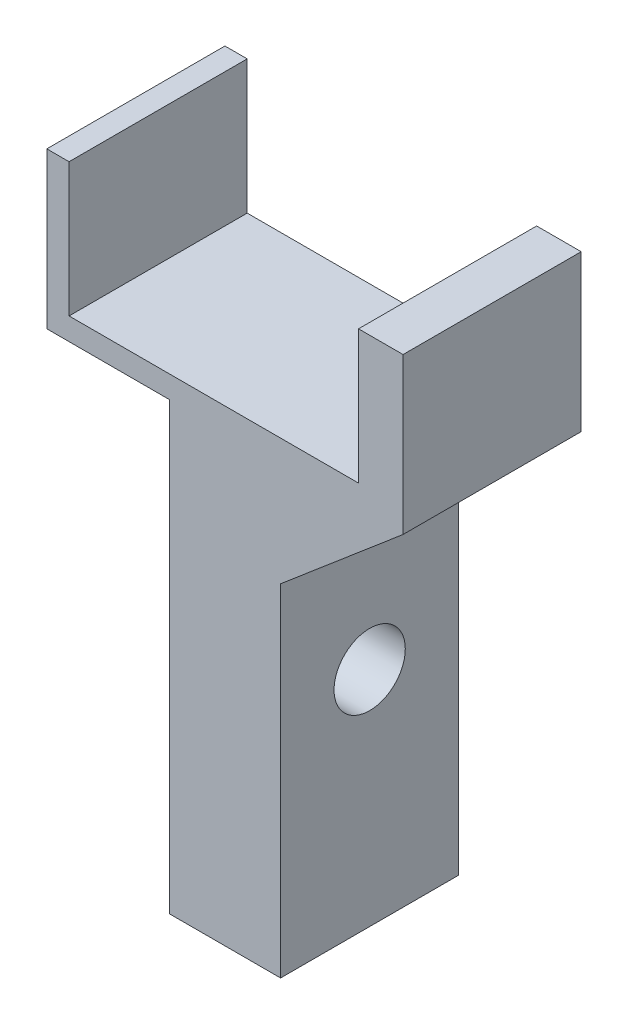
from build123d import *

# Parameters (mm, degrees)
EXTRUDE_4_DEPTH     = 8
SKETCH_7_W          = 13
SKETCH_7_H          = 6.499106166
CUT_EXTRUDE_3_DEPTH = 31.054117854
SKETCH_8_R          = 1.6
CUT_EXTRUDE_4_DEPTH = 31.054117854


with BuildPart() as part:
    # 草图6 → 凸台-拉伸4 (new body)
    with BuildSketch(Plane.XY):
        Polygon((-5, 20), (-10.5, 20), (-10.5, 27), (5.5, 27), (5.5, 20), (0, 15.33359454), (0, 0), (-5, 0), align=None)
    extrude(amount=EXTRUDE_4_DEPTH)

    # 草图7 → 切除-拉伸3 (cut, through all)
    with BuildSketch(Plane(origin=(0, 0, 0), x_dir=(-1, 0, 0), z_dir=(0, 0, -1))):
        with Locations((3, 24.249553083)):
            Rectangle(SKETCH_7_W, SKETCH_7_H)
    extrude(amount=-CUT_EXTRUDE_3_DEPTH, mode=Mode.SUBTRACT)

    # 草图8 → 切除-拉伸4 (cut, through all)
    with BuildSketch(Plane(origin=(0, 0, 0), x_dir=(0, 0, -1), z_dir=(1, 0, 0))):
        with Locations((-4, 10)):
            Circle(SKETCH_8_R)
    extrude(amount=-CUT_EXTRUDE_4_DEPTH, mode=Mode.SUBTRACT)


solid = part.part
